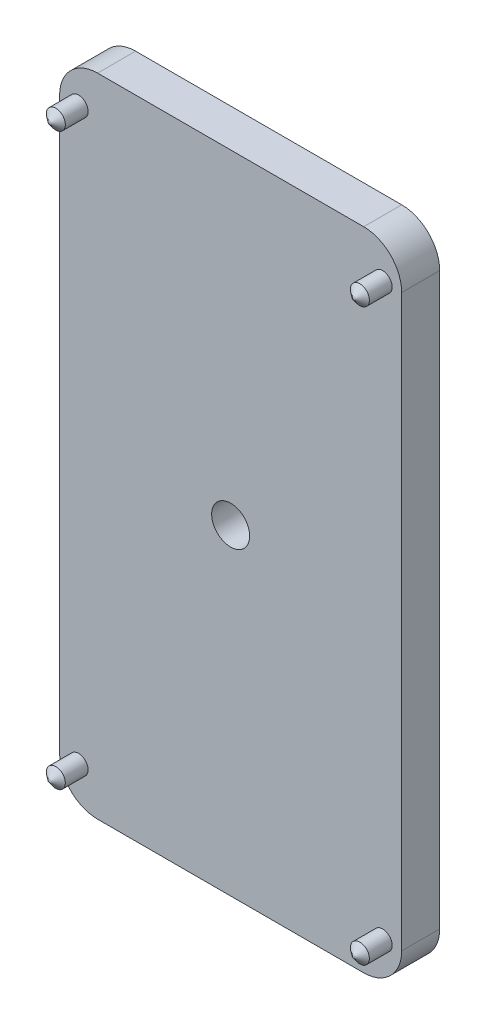
from build123d import *

# Parameters (mm, degrees)
SKETCH2_W           = 90
SKETCH2_H           = 170
BOSS_EXTRUDE1_DEPTH = 10
SKETCH3_R           = 2.5
BOSS_EXTRUDE4_DEPTH = 6
SKETCH9_R           = 2.5
BOSS_EXTRUDE6_DEPTH = 15
SKETCH10_R          = 5
CUT_EXTRUDE3_DEPTH  = 15
FILLET1_R           = 10
FILLET2_R           = 10
FILLET3_R           = 10
FILLET4_R           = 10


with BuildPart() as part:
    # Sketch2 → Boss-Extrude1 (new body)
    with BuildSketch(Plane.XY):
        with Locations((45, 85)):
            Rectangle(SKETCH2_W, SKETCH2_H)
    extrude(amount=BOSS_EXTRUDE1_DEPTH)

    # Sketch3 → Boss-Extrude4 (add)
    with BuildSketch(Plane.XY.offset(10)):
        with Locations(Location((5, 160, 0), (0, 0, 180))):
            Circle(SKETCH3_R)
        with Locations(Location((85, 160, 0), (0, 0, 180))):
            Circle(SKETCH3_R)
        with Locations(Location((85, 10, 0), (0, 0, 180))):
            Circle(SKETCH3_R)
        with Locations(Location((5, 10, 0), (0, 0, 180))):
            Circle(SKETCH3_R)
    extrude(amount=BOSS_EXTRUDE4_DEPTH)

    # Boss-Extrude5 cone 1 section (through the dimple's axis) → Boss-Extrude5 (revolve)
    with BuildSketch(Plane(origin=(5, 160, 16), x_dir=(0, 1, 0), z_dir=(1, 0, 0))):
        Polygon((0, 0), (2.5, 0), (0, 1.953214066), align=None)
    revolve(axis=Axis((5, 160, 16), (0, 0, 1)))

    # Boss-Extrude5 cone 2 section (through the dimple's axis) → Boss-Extrude5 cone 2 (revolve)
    with BuildSketch(Plane(origin=(85, 160, 16), x_dir=(0, 1, 0), z_dir=(1, 0, 0))):
        Polygon((0, 0), (2.5, 0), (0, 1.953214066), align=None)
    revolve(axis=Axis((85, 160, 16), (0, 0, 1)))

    # Boss-Extrude5 cone 3 section (through the dimple's axis) → Boss-Extrude5 cone 3 (revolve)
    with BuildSketch(Plane(origin=(85, 10, 16), x_dir=(0, 1, 0), z_dir=(1, 0, 0))):
        Polygon((0, 0), (2.5, 0), (0, 1.953214066), align=None)
    revolve(axis=Axis((85, 10, 16), (0, 0, 1)))

    # Boss-Extrude5 cone 4 section (through the dimple's axis) → Boss-Extrude5 cone 4 (revolve)
    with BuildSketch(Plane(origin=(5, 10, 16), x_dir=(0, 1, 0), z_dir=(1, 0, 0))):
        Polygon((0, 0), (2.5, 0), (0, 1.953214066), align=None)
    revolve(axis=Axis((5, 10, 16), (0, 0, 1)))

    # Sketch9 → Boss-Extrude6 (add)
    with BuildSketch(Plane(origin=(0, 0, 0), x_dir=(-1, 0, 0), z_dir=(0, 0, -1))):
        with Locations((-45, 150)):
            Circle(SKETCH9_R)
    extrude(amount=BOSS_EXTRUDE6_DEPTH)

    # Sketch10 → Cut-Extrude3 (cut)
    with BuildSketch(Plane(origin=(0, 0, 0), x_dir=(-1, 0, 0), z_dir=(0, 0, -1))):
        with Locations((-45, 84.5110045)):
            Circle(SKETCH10_R)
    extrude(amount=-CUT_EXTRUDE3_DEPTH, mode=Mode.SUBTRACT)

    # Fillet1
    fillet1_edges = [part.edges().sort_by_distance(p)[0] for p in [
        (90, 170, 5),
    ]]
    fillet(fillet1_edges, radius=FILLET1_R)

    # Fillet2
    fillet2_edges = [part.edges().sort_by_distance(p)[0] for p in [
        (0, 170, 5),
    ]]
    fillet(fillet2_edges, radius=FILLET2_R)

    # Fillet3
    fillet3_edges = [part.edges().sort_by_distance(p)[0] for p in [
        (0, 0, 5),
    ]]
    fillet(fillet3_edges, radius=FILLET3_R)

    # Fillet4
    fillet4_edges = [part.edges().sort_by_distance(p)[0] for p in [
        (90, 0, 5),
    ]]
    fillet(fillet4_edges, radius=FILLET4_R)


solid = part.part
